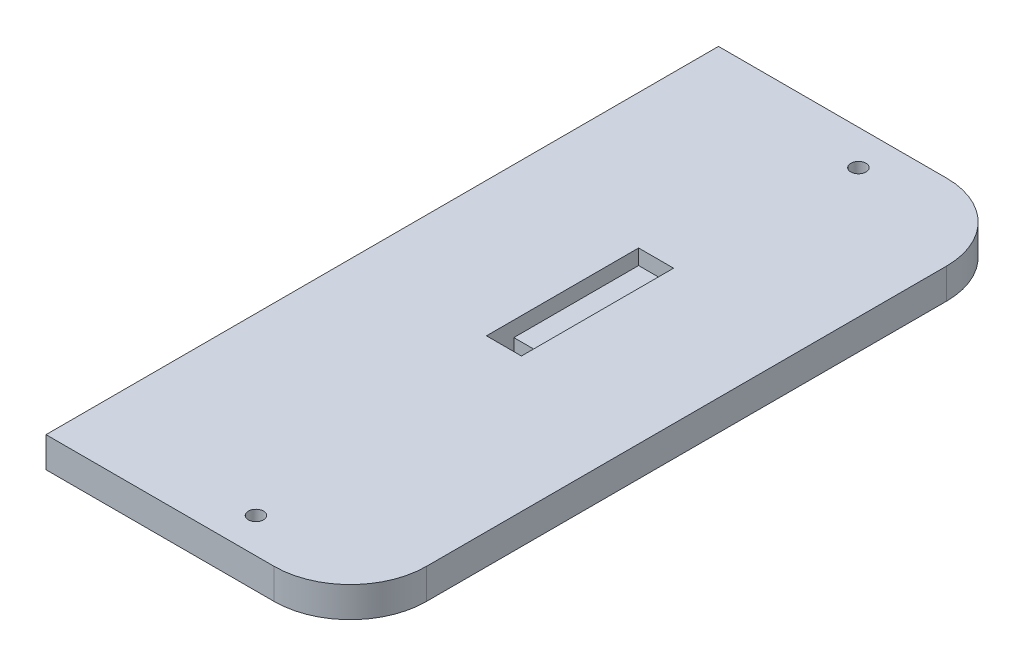
from build123d import *

# Parameters (mm, degrees)
SKETCH1_W           = 40
SKETCH1_H           = 88.4
BOSS_EXTRUDE1_DEPTH = 4
FILLET1_R           = 10
SKETCH3_R           = 1
CUT_EXTRUDE1_DEPTH  = 10
SKETCH5_R           = 1.6
CUT_EXTRUDE2_DEPTH  = 2.5
CUT_EXTRUDE3_START  = -2
SKETCH6_W           = 4.6
SKETCH6_H           = 20
CUT_EXTRUDE3_DEPTH  = 10
SKETCH8_W           = 4.6
SKETCH8_H           = 3.6
CUT_EXTRUDE7_DEPTH  = 11.5


with BuildPart() as part:
    # Sketch1 → Boss-Extrude1 (new body)
    with BuildSketch(Plane(origin=(0, 0, 0), x_dir=(1, 0, 0), z_dir=(0, 1, 0))):
        with Locations((20, 44.2)):
            Rectangle(SKETCH1_W, SKETCH1_H)
    extrude(amount=BOSS_EXTRUDE1_DEPTH)

    # Fillet1
    fillet1_edges = [part.edges().sort_by_distance(p)[0] for p in [
        (40, 2, -88.4),
        (40, 2, 0),
    ]]
    fillet(fillet1_edges, radius=FILLET1_R)

    # Sketch3 → Cut-Extrude1 (cut)
    with BuildSketch(Plane.XZ):
        with Locations(Location((23, -4.6, 0), (0, 0, 270))):
            Circle(SKETCH3_R)
        with Locations(Location((23, -83.8, 0), (0, 0, 270))):
            Circle(SKETCH3_R)
    extrude(amount=-CUT_EXTRUDE1_DEPTH, mode=Mode.SUBTRACT)

    # Sketch5 → Cut-Extrude2 (cut)
    with BuildSketch(Plane.XZ):
        with Locations(Location((23, -4.6, 0), (0, 0, 270))):
            Circle(SKETCH5_R)
        with Locations(Location((23, -83.8, 0), (0, 0, 270))):
            Circle(SKETCH5_R)
    extrude(amount=-CUT_EXTRUDE2_DEPTH, mode=Mode.SUBTRACT)

    # Sketch6 → Cut-Extrude3 (cut)
    with BuildSketch(Plane.XZ.offset(CUT_EXTRUDE3_START)):
        with Locations((20, -50.2)):
            Rectangle(SKETCH6_W, SKETCH6_H)
    extrude(amount=-CUT_EXTRUDE3_DEPTH, mode=Mode.SUBTRACT)

    # Sketch8 → Cut-Extrude7 (cut)
    with BuildSketch(Plane(origin=(0, 2, 0), x_dir=(1, 0, 0), z_dir=(0, 1, 0))):
        with Locations((20, 42)):
            Rectangle(SKETCH8_W, SKETCH8_H)
    extrude(amount=-CUT_EXTRUDE7_DEPTH, mode=Mode.SUBTRACT)


solid = part.part
